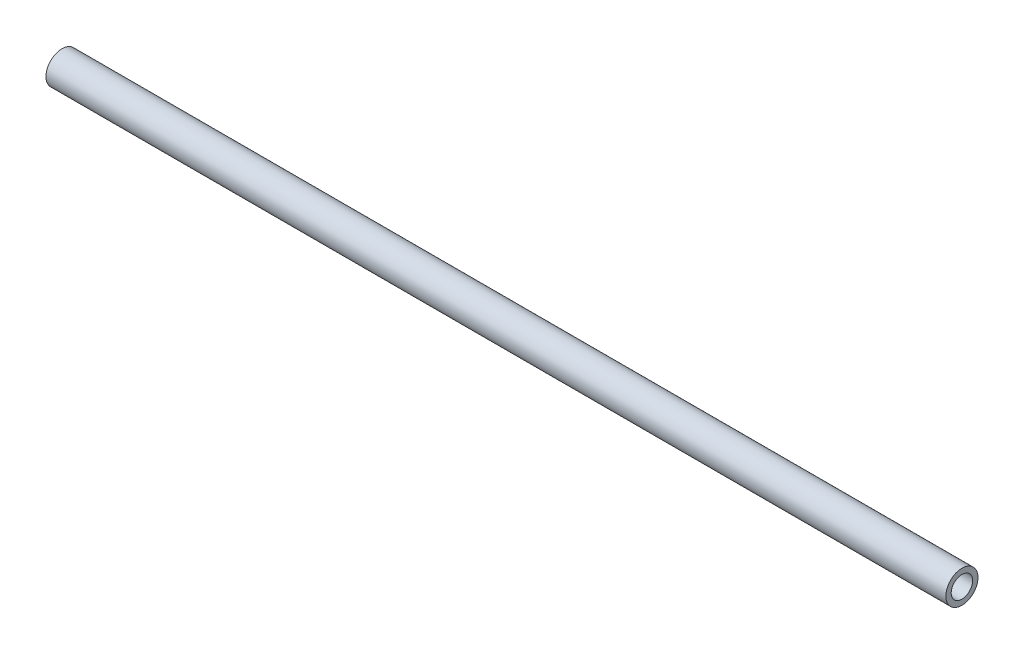
from build123d import *

# Parameters (mm, degrees)
SKETCH3_R           = 9.525
SKETCH3_R_2         = 6.35
BOSS_EXTRUDE1_DEPTH = 266.7


with BuildPart() as part:
    # Sketch3 → Boss-Extrude1 (new, symmetric)
    with BuildSketch(Plane(origin=(0, 0, 0), x_dir=(0, 0, -1), z_dir=(1, 0, 0))):
        Circle(SKETCH3_R)
        Circle(SKETCH3_R_2, mode=Mode.SUBTRACT)
    extrude(amount=BOSS_EXTRUDE1_DEPTH, both=True)


solid = part.part
